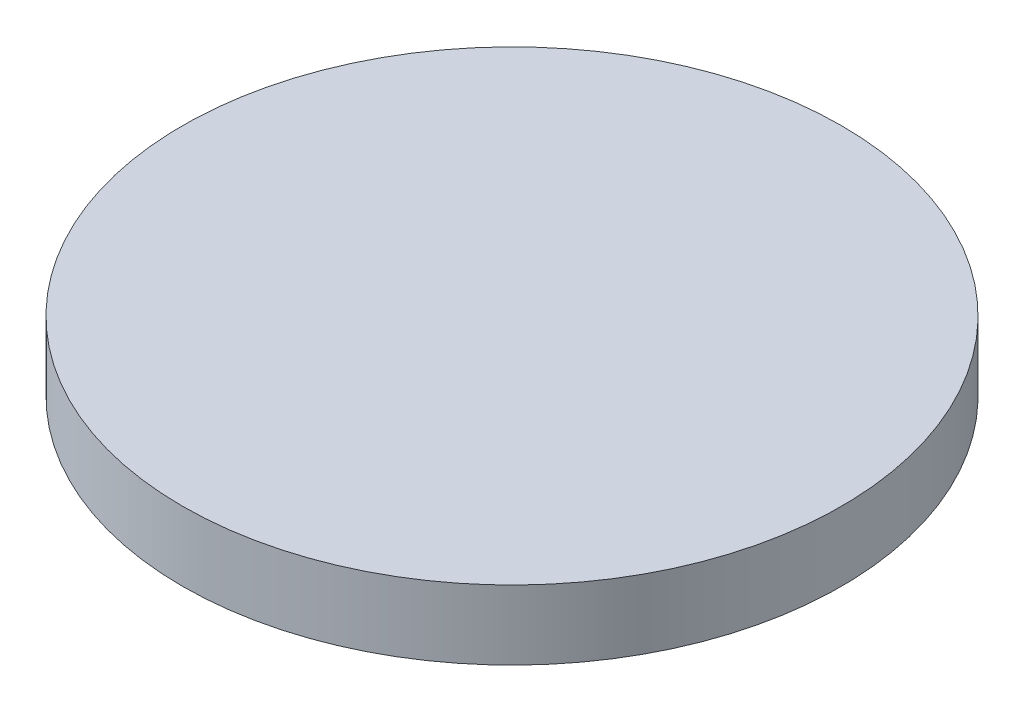
from build123d import *

# Parameters (mm, degrees)
SKETCH_1_R         = 57
EXTRUDE_D114_DEPTH = 12


with BuildPart() as part:
    # 草图1 → D114 主观察窗 (new body)
    with BuildSketch(Plane(origin=(0, 0, 0), x_dir=(1, 0, 0), z_dir=(0, 1, 0))):
        with Locations(Location((0, 0, 0), (0, 0, 270))):
            Circle(SKETCH_1_R)
    extrude(amount=EXTRUDE_D114_DEPTH)


solid = part.part
